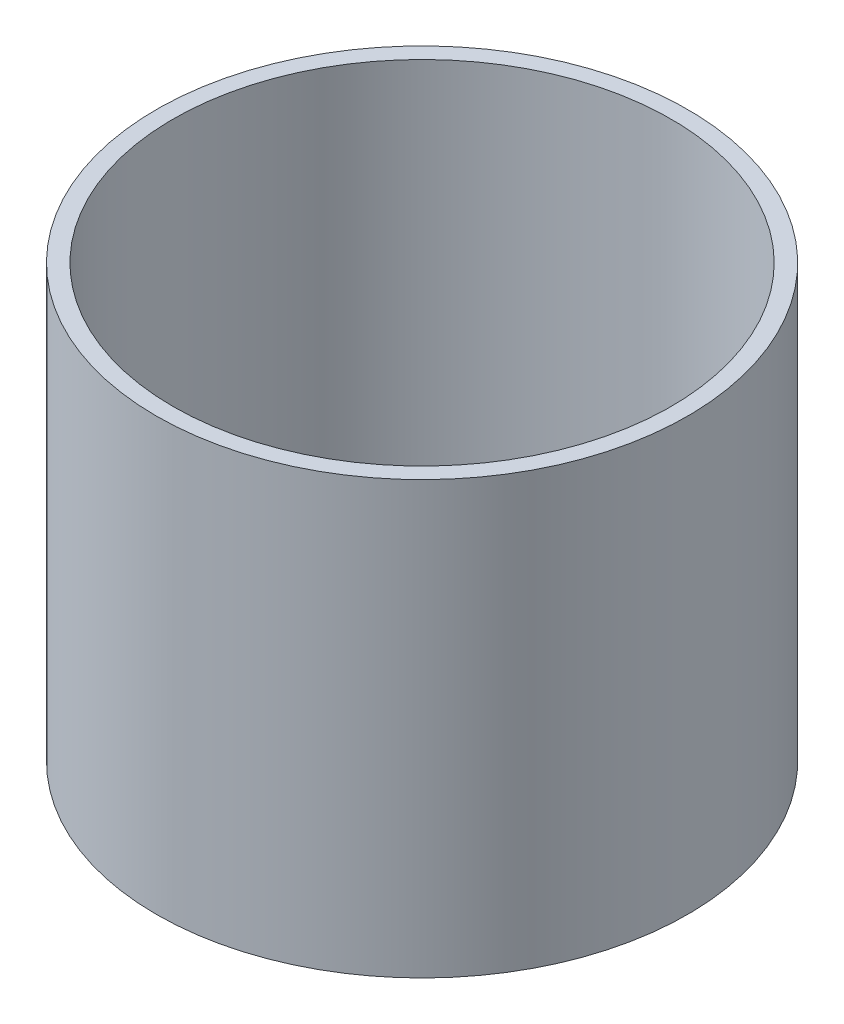
from build123d import *

# Parameters (mm, degrees)
SKETCH1_R           = 40
SKETCH1_R_2         = 37.5
BOSS_EXTRUDE1_DEPTH = 65


with BuildPart() as part:
    # Sketch1 → Boss-Extrude1 (new body)
    with BuildSketch(Plane(origin=(0, 0, 0), x_dir=(1, 0, 0), z_dir=(0, 1, 0))):
        with Locations(Location((0, 0, 0), (0, 0, 270))):
            Circle(SKETCH1_R)
        with Locations(Location((0, 0, 0), (0, 0, 270))):
            Circle(SKETCH1_R_2, mode=Mode.SUBTRACT)
    extrude(amount=BOSS_EXTRUDE1_DEPTH)


solid = part.part
